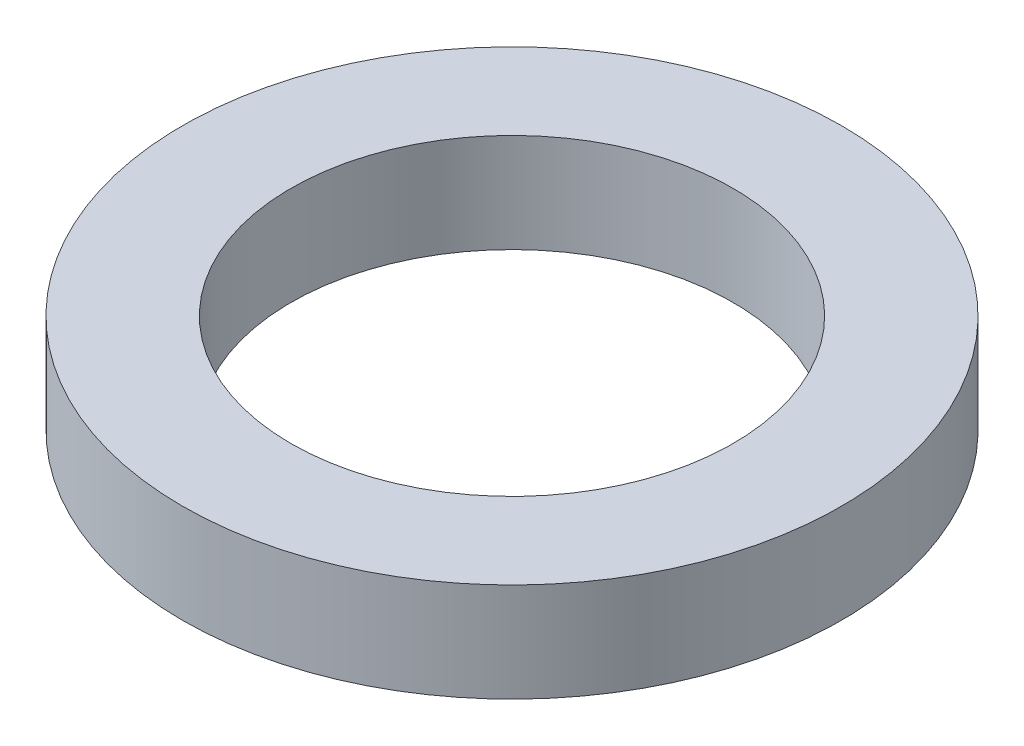
from build123d import *

# Parameters (mm, degrees)
SKETCH_1_W = 1.975
SKETCH_1_H = 1.8


with BuildPart() as part:
    # 스케치1 → 회전1 (revolve)
    with BuildSketch(Plane(origin=(0, 0, 0), x_dir=(-1, 0, 0), z_dir=(0, 0, -1)), mode=Mode.PRIVATE) as revolve_1_sk:
        with Locations((-5.0125, 0.9)):
            Rectangle(SKETCH_1_W, SKETCH_1_H)
    revolve(revolve_1_sk.sketch.rotate(Axis((0, 0, 0), (0, 1, 0)), 270), axis=Axis((0, 0, 0), (0, 1, 0)))


solid = part.part
